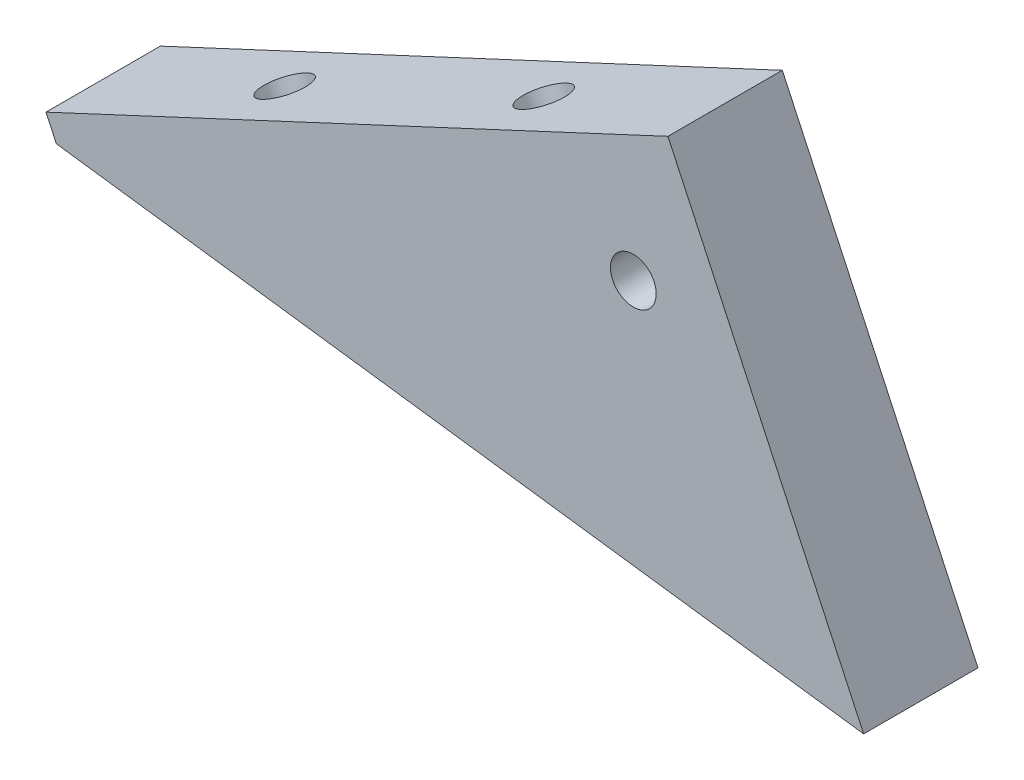
from build123d import *

# Parameters (mm, degrees)
BOSS_EXTRUDE1_DEPTH = 10
SKETCH2_R           = 2
CUT_EXTRUDE1_DEPTH  = 127.229561877
CUT_EXTRUDE2_START  = -4
SKETCH2_3_R         = 2
CUT_EXTRUDE2_DEPTH  = 123.229561877
SKETCH3_R           = 2
CUT_EXTRUDE3_DEPTH  = 10
SKETCH4_R           = 2
CUT_EXTRUDE4_DEPTH  = 10
CUT_EXTRUDE5_START  = -5
SKETCH4_3_R         = 2
CUT_EXTRUDE5_DEPTH  = 5


with BuildPart() as part:
    # Sketch1 → Boss-Extrude1 (new body)
    with BuildSketch(Plane.XY):
        Polygon((125.280696375, -8.107729541), (108.169003487, 28.58841428), (53.790536264, 3.231318576), (54.697191201, 1.286990791), align=None)
    extrude(amount=-BOSS_EXTRUDE1_DEPTH)

    # Sketch2 → Cut-Extrude1 (cut, through all)
    with BuildSketch(Plane(origin=(8.369656198, -17.948785639, 0), x_dir=(0.9063077870366519, 0.4226182617406953, 0), z_dir=(-0.42261826174069533, 0.906307787036652, 0))):
        with Locations(Location((67.616396125, 5, 0), (0, 0, 180))):
            Circle(SKETCH2_R)
        with Locations(Location((92.616396125, 5, 0), (0, 0, 180))):
            Circle(SKETCH2_R)
    extrude(amount=-CUT_EXTRUDE1_DEPTH, mode=Mode.SUBTRACT)

    # Sketch2<3> → Cut-Extrude2 (cut, through all)
    # profile 1 of 2: a face of its own
    with BuildSketch(Plane(origin=(8.369656198, -17.948785639, 0), x_dir=(0.9063077870366519, 0.4226182617406953, 0), z_dir=(-0.42261826174069533, 0.906307787036652, 0)).offset(CUT_EXTRUDE2_START)):
        Polygon((92.616396125, 0.958548116), (96.116396125, 2.979274058), (96.116396125, 7.020725942), (92.616396125, 9.041451884), (89.116396125, 7.020725942), (89.116396125, 2.979274058), align=None)
        with Locations(Location((92.616396125, 5, 0), (0, 0, 180))):
            Circle(SKETCH2_3_R, mode=Mode.SUBTRACT)
    # profile 2 of 2: a face of its own
    with BuildSketch(Plane(origin=(8.369656198, -17.948785639, 0), x_dir=(0.9063077870366519, 0.4226182617406953, 0), z_dir=(-0.42261826174069533, 0.906307787036652, 0)).offset(CUT_EXTRUDE2_START)):
        Polygon((71.116396125, 2.979274058), (67.616396125, 0.958548116), (64.116396125, 2.979274058), (64.116396125, 7.020725942), (67.616396125, 9.041451884), (71.116396125, 7.020725942), align=None)
        with Locations(Location((67.616396125, 5, 0), (0, 0, 180))):
            Circle(SKETCH2_3_R, mode=Mode.SUBTRACT)
    extrude(amount=-CUT_EXTRUDE2_DEPTH, mode=Mode.SUBTRACT)

    # Sketch3 → Cut-Extrude3 (cut)
    with BuildSketch(Plane(origin=(1.120455323, 8.418096686, 0), x_dir=(0.9912580726255896, -0.1319372330110102, 0), z_dir=(-0.1319372330110102, -0.9912580726255896, 0))):
        with Locations((87.714258049, -5)):
            Circle(SKETCH3_R)
        with Locations((113.315595618, -5)):
            Circle(SKETCH3_R)
    extrude(amount=-CUT_EXTRUDE3_DEPTH, mode=Mode.SUBTRACT)

    # Sketch4 → Cut-Extrude4 (cut)
    with BuildSketch(Plane.XY):
        with Locations((105.144723808, 16.144390316)):
            Circle(SKETCH4_R)
    extrude(amount=-CUT_EXTRUDE4_DEPTH, mode=Mode.SUBTRACT)

    # Sketch4<3> → Cut-Extrude5 (cut)
    with BuildSketch(Plane.XY.offset(CUT_EXTRUDE5_START)):
        Polygon((109.170796748, 15.792154575), (107.462805377, 19.454953889), (103.436732437, 19.80718963), (101.118650868, 16.496626057), (102.826642238, 12.833826743), (106.852715178, 12.481591002), align=None)
        with Locations((105.144723808, 16.144390316)):
            Circle(SKETCH4_3_R, mode=Mode.SUBTRACT)
    extrude(amount=-CUT_EXTRUDE5_DEPTH, mode=Mode.SUBTRACT)


solid = part.part
